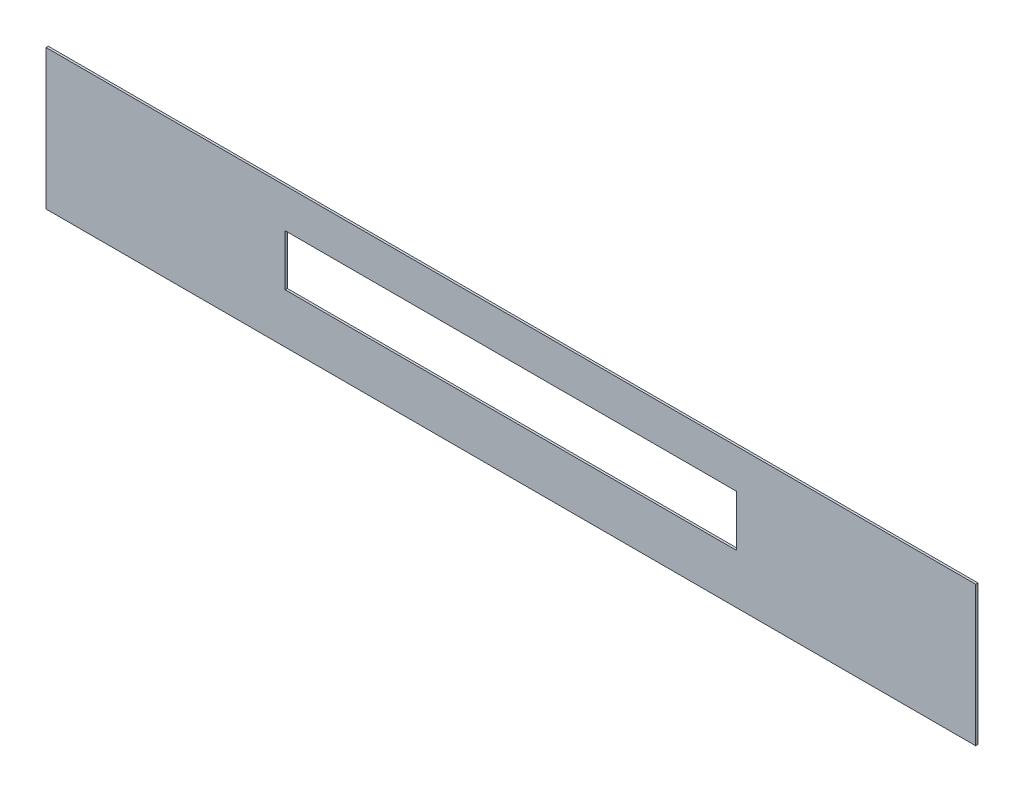
from build123d import *

# Parameters (mm, degrees)
CEK_TAZE_ON_DIS_SAC_1_5_1_START = 38.5
SKETCH1_W                       = 618
SKETCH1_H                       = 93
CEK_TAZE_ON_DIS_SAC_1_5_1_DEPTH = 1.5
CEK_TAZE_ON_DIS_SAC_1_5_2_START = 27
SKETCH2_W                       = 300
SKETCH2_H                       = 34
CEK_TAZE_ON_DIS_SAC_1_5_2_DEPTH = 14


with BuildPart() as part:
    # Sketch1 → CEK_taze_on_dis_sac_1.5_1 (new body)
    with BuildSketch(Plane.XY.offset(CEK_TAZE_ON_DIS_SAC_1_5_1_START)):
        with Locations((309, 46.5)):
            Rectangle(SKETCH1_W, SKETCH1_H)
    extrude(amount=CEK_TAZE_ON_DIS_SAC_1_5_1_DEPTH)

    # Sketch2 → CEK_taze_on_dis_sac_1.5_2 (cut)
    with BuildSketch(Plane.XY.offset(CEK_TAZE_ON_DIS_SAC_1_5_2_START)):
        with Locations((309, 50)):
            Rectangle(SKETCH2_W, SKETCH2_H)
    extrude(amount=CEK_TAZE_ON_DIS_SAC_1_5_2_DEPTH, mode=Mode.SUBTRACT)


solid = part.part
